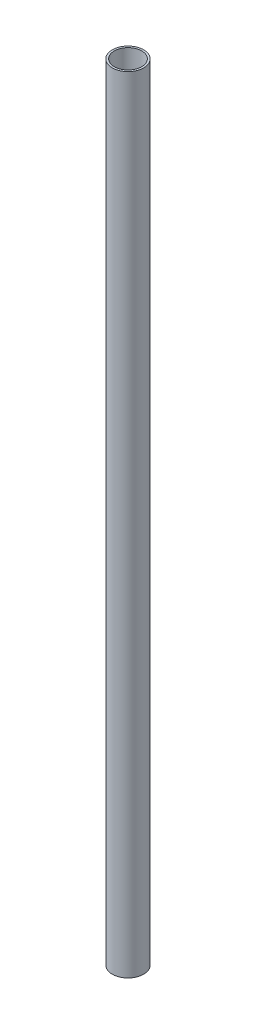
from build123d import *

# Parameters (mm, degrees)
SKETCH1_R           = 8
SKETCH1_R_2         = 7
BOSS_EXTRUDE1_DEPTH = 200


with BuildPart() as part:
    # Sketch1 → Boss-Extrude1 (new, symmetric)
    with BuildSketch(Plane(origin=(0, 0, 0), x_dir=(1, 0, 0), z_dir=(0, 1, 0))):
        with Locations(Location((0, 0, 0), (0, 0, 270))):
            Circle(SKETCH1_R)
        with Locations(Location((0, 0, 0), (0, 0, 270))):
            Circle(SKETCH1_R_2, mode=Mode.SUBTRACT)
    extrude(amount=BOSS_EXTRUDE1_DEPTH, both=True)


solid = part.part
